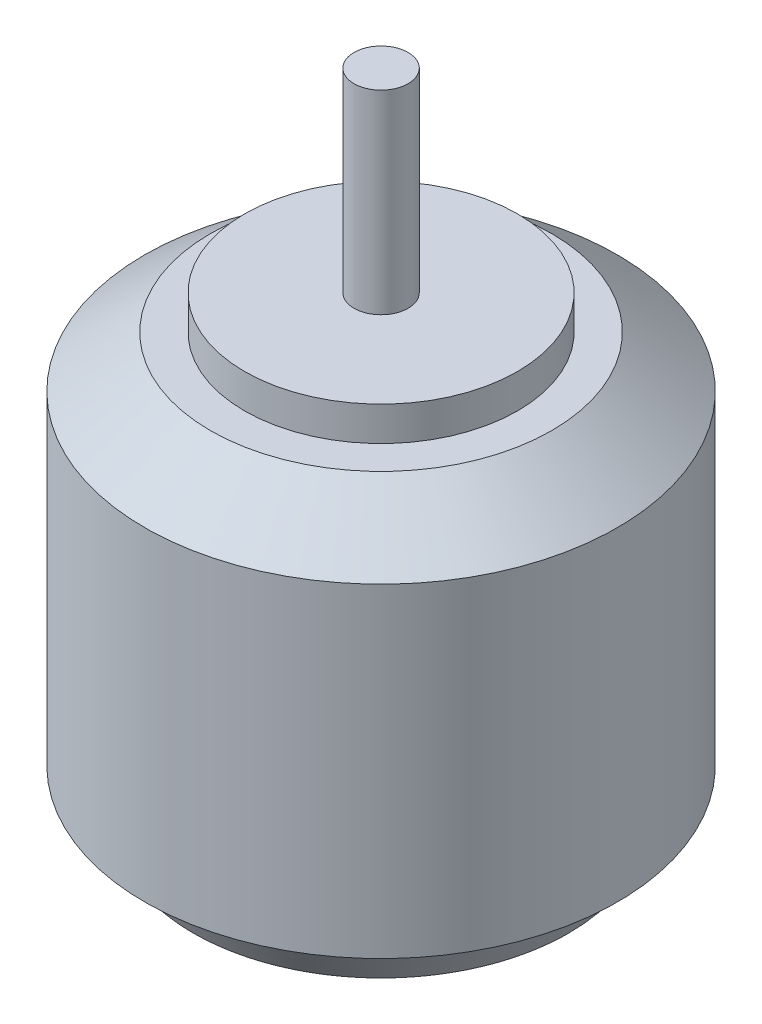
from build123d import *

# Parameters (mm, degrees)
SKETCH3_R          = 1.5
CUT_EXTRUDE1_DEPTH = 10


with BuildPart() as part:
    # Sketch2 → Revolve1 (revolve)
    with BuildSketch(Plane.XY, mode=Mode.PRIVATE) as revolve1_sk:
        Polygon((0, 0), (11, 0), (12.732050808, 3), (13.85, 3), (13.85, 22), (10, 25), (8, 25), (8, 27), (1.585, 27), (1.585, 38.4), (0, 38.4), align=None)
    revolve(revolve1_sk.sketch.rotate(Axis((0, 38.4, 0), (0, -1, 0)), 180), axis=Axis((0, 38.4, 0), (0, -1, 0)))

    # Sketch3 → Cut-Extrude1 (cut)
    with BuildSketch(Plane.XZ):
        with Locations((9.5, 0)):
            Circle(SKETCH3_R)
        with Locations((-8, 0)):
            Circle(SKETCH3_R)
        with Locations((0, 9.5)):
            Circle(SKETCH3_R)
        with Locations((0, -9.5)):
            Circle(SKETCH3_R)
    extrude(amount=-CUT_EXTRUDE1_DEPTH, mode=Mode.SUBTRACT)


solid = part.part
